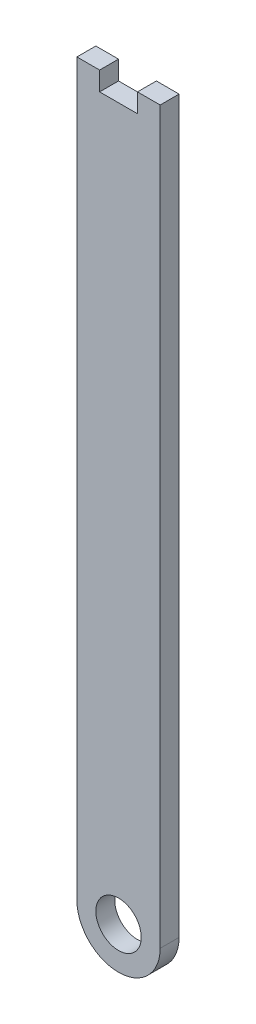
from build123d import *

# Parameters (mm, degrees)
SKETCH1_R           = 6
BOSS_EXTRUDE1_DEPTH = 2.5


with BuildPart() as part:
    # Sketch1 → Boss-Extrude1 (new, symmetric)
    with BuildSketch(Plane(origin=(0, 0, 0), x_dir=(0, 1, 0), z_dir=(0, 0, 1))):
        with BuildLine():
            Line((0, 11), (193, 11))
            Line((193, 11), (193, 5))
            Line((193, 5), (188, 5))
            Line((188, 5), (188, -5))
            Line((188, -5), (193, -5))
            Line((193, -5), (193, -11))
            Line((193, -11), (0, -11))
            ThreePointArc((0, -11), (-11, 0), (0, 11))
        make_face()
        with Locations(Location((0, 0, 0), (0, 0, 270))):
            Circle(SKETCH1_R, mode=Mode.SUBTRACT)
    extrude(amount=BOSS_EXTRUDE1_DEPTH, both=True)


solid = part.part
